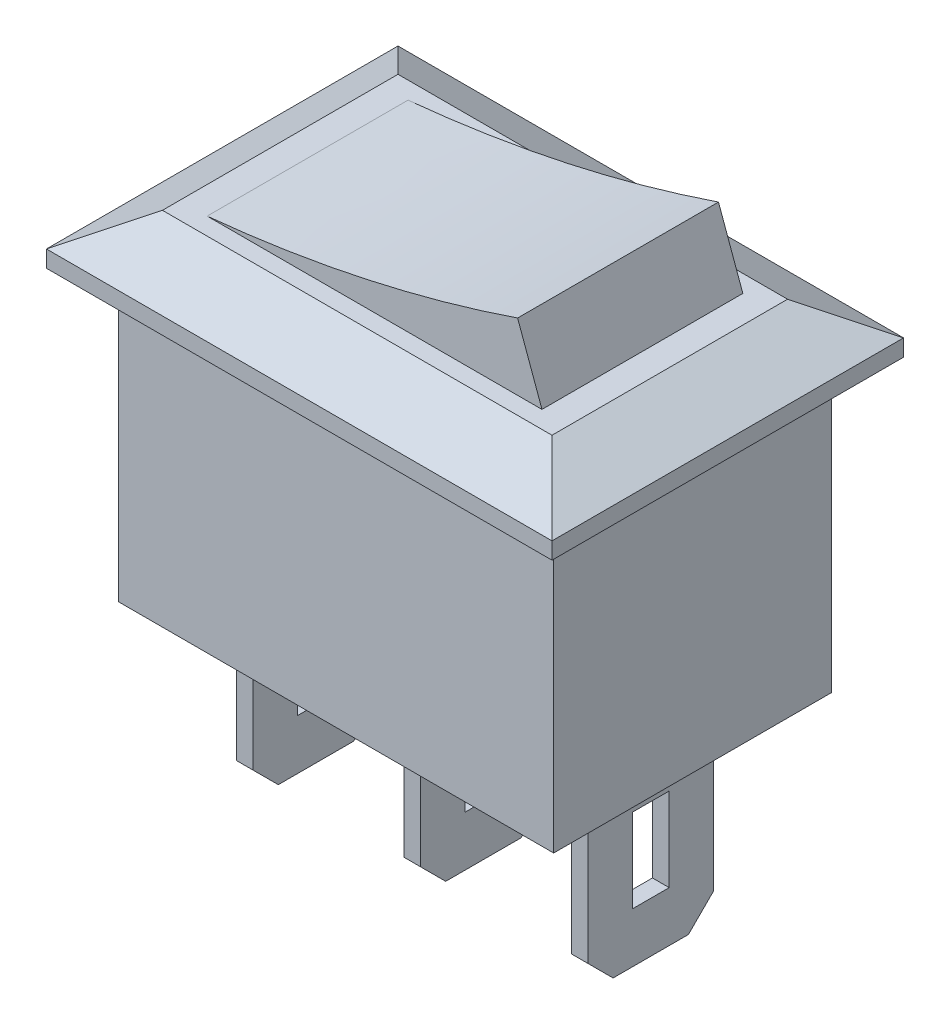
from build123d import *
from OCP.BRepFilletAPI import BRepFilletAPI_MakeChamfer

# Parameters (mm, degrees)
SKETCH1_W           = 13
SKETCH1_H           = 8.3
BOSS_EXTRUDE1_DEPTH = 8.65
SKETCH3_W           = 15.1
SKETCH3_H           = 10.5
BOSS_EXTRUDE2_DEPTH = 1.5
CHAMFER1_SIZE       = 1
CHAMFER1_SIZE2      = 1.732050808
SKETCH4_W           = 10
SKETCH4_H           = 6
BOSS_EXTRUDE3_DEPTH = 2
CUT_EXTRUDE2_DEPTH  = 6
SKETCH6_W           = 0.5
SKETCH6_H           = 3.75
BOSS_EXTRUDE4_DEPTH = 5.37
CHAMFER2_SIZE       = 0.75
CUT_EXTRUDE3_REACH  = 20.413
SKETCH7_W           = 1.1
SKETCH7_H           = 2.5


with BuildPart() as part:
    # Sketch1 → Boss-Extrude1 (new body)
    with BuildSketch(Plane(origin=(0, 0, 0), x_dir=(1, 0, 0), z_dir=(0, 1, 0))):
        Rectangle(SKETCH1_W, SKETCH1_H)
    extrude(amount=BOSS_EXTRUDE1_DEPTH)

    # Sketch3 → Boss-Extrude2 (add)
    with BuildSketch(Plane(origin=(0, 8.65, 0), x_dir=(1, 0, 0), z_dir=(0, 1, 0))):
        Rectangle(SKETCH3_W, SKETCH3_H)
    extrude(amount=BOSS_EXTRUDE2_DEPTH)

    # Chamfer1: one chamfer whose edges measure the first distance from different faces: ONE call of the kernel's chamfer builder (chamfer() names one face for all edges)
    chamfer1_edges_1 = [part.edges().sort_by_distance(p)[0] for p in [
        (-7.55, 10.15, 0),
    ]]
    chamfer1_side_1 = [part.faces().sort_by_distance(p)[0] for p in [
        (-7.55, 9.4, 0),
    ]]
    chamfer1_edges_2 = [part.edges().sort_by_distance(p)[0] for p in [
        (0, 10.15, 5.25),
    ]]
    chamfer1_side_2 = [part.faces().sort_by_distance(p)[0] for p in [
        (0, 9.4, 5.25),
    ]]
    chamfer1_edges_3 = [part.edges().sort_by_distance(p)[0] for p in [
        (7.55, 10.15, 0),
    ]]
    chamfer1_side_3 = [part.faces().sort_by_distance(p)[0] for p in [
        (7.55, 9.4, 0),
    ]]
    chamfer1_edges_4 = [part.edges().sort_by_distance(p)[0] for p in [
        (0, 10.15, -5.25),
    ]]
    chamfer1_side_4 = [part.faces().sort_by_distance(p)[0] for p in [
        (0, 9.4, -5.25),
    ]]
    chamfer1 = BRepFilletAPI_MakeChamfer(part.part.solid().wrapped)
    for e in chamfer1_edges_1:
        chamfer1.Add(CHAMFER1_SIZE, CHAMFER1_SIZE2, e.wrapped, chamfer1_side_1[0].wrapped)  # the first distance lies on this face
    for e in chamfer1_edges_2:
        chamfer1.Add(CHAMFER1_SIZE, CHAMFER1_SIZE2, e.wrapped, chamfer1_side_2[0].wrapped)  # the first distance lies on this face
    for e in chamfer1_edges_3:
        chamfer1.Add(CHAMFER1_SIZE, CHAMFER1_SIZE2, e.wrapped, chamfer1_side_3[0].wrapped)  # the first distance lies on this face
    for e in chamfer1_edges_4:
        chamfer1.Add(CHAMFER1_SIZE, CHAMFER1_SIZE2, e.wrapped, chamfer1_side_4[0].wrapped)  # the first distance lies on this face
    add(Compound.cast(chamfer1.Shape()), mode=Mode.REPLACE)

    # Sketch4 → Boss-Extrude3 (add)
    with BuildSketch(Plane(origin=(0, 10.15, 0), x_dir=(1, 0, 0), z_dir=(0, 1, 0))):
        Rectangle(SKETCH4_W, SKETCH4_H)
    extrude(amount=BOSS_EXTRUDE3_DEPTH)

    # Sketch5 → Cut-Extrude2 (cut)
    with BuildSketch(Plane(origin=(0, 0, -3), x_dir=(-1, 0, 0), z_dir=(0, 0, -1))):
        with BuildLine():
            Line((5, 12.15), (-4.272059531, 12.15))
            add(Edge.make_bspline(
                [(-4.272059531, 12.15), (0.251528144, 10.609590956), (5, 10.15)],
                knots=[0, 0, 0, 1, 1, 1], degree=2))
            Line((5, 10.15), (5, 12.15))
        make_face()
        Polygon((-5, 12.15), (-5, 10.15), (-4.272059531, 12.15), align=None)
    extrude(amount=-CUT_EXTRUDE2_DEPTH, mode=Mode.SUBTRACT)

    # Sketch6 → Boss-Extrude4 (add)
    with BuildSketch(Plane.XZ):
        Rectangle(SKETCH6_W, SKETCH6_H)
        with Locations((5, 0)):
            Rectangle(SKETCH6_W, SKETCH6_H)
        with Locations((-5, 0)):
            Rectangle(SKETCH6_W, SKETCH6_H)
    extrude(amount=BOSS_EXTRUDE4_DEPTH)

    # Chamfer2
    chamfer2_edges = [part.edges().sort_by_distance(p)[0] for p in [
        (0, -5.37, 1.875),
        (0, -5.37, -1.875),
        (5, -5.37, 1.875),
        (5, -5.37, -1.875),
        (-5, -5.37, 1.875),
        (-5, -5.37, -1.875),
    ]]
    chamfer(chamfer2_edges, length=CHAMFER2_SIZE)

    # Cut-Extrude3: up to this face of the body (flat: up to its plane)
    cut_extrude3_end = Plane(part.part.faces().sort_by_distance((5.25, -2.615028736, 0))[0])
    # Sketch7 → Cut-Extrude3 (cut, up to the picked face)
    with BuildSketch(Plane.ZY.offset(5.25), mode=Mode.PRIVATE) as cut_extrude3_sk1:
        with Locations((0, -2.62)):
            Rectangle(SKETCH7_W, SKETCH7_H)
    cut_extrude3_tool1 = split(extrude(cut_extrude3_sk1.sketch, amount=-CUT_EXTRUDE3_REACH, mode=Mode.PRIVATE), bisect_by=cut_extrude3_end, keep=Keep.BOTH, mode=Mode.PRIVATE)
    add(cut_extrude3_tool1.solids().sort_by(Axis((-5.25, -2.62, 0), (1, 0, 0)))[0], mode=Mode.SUBTRACT)


solid = part.part
